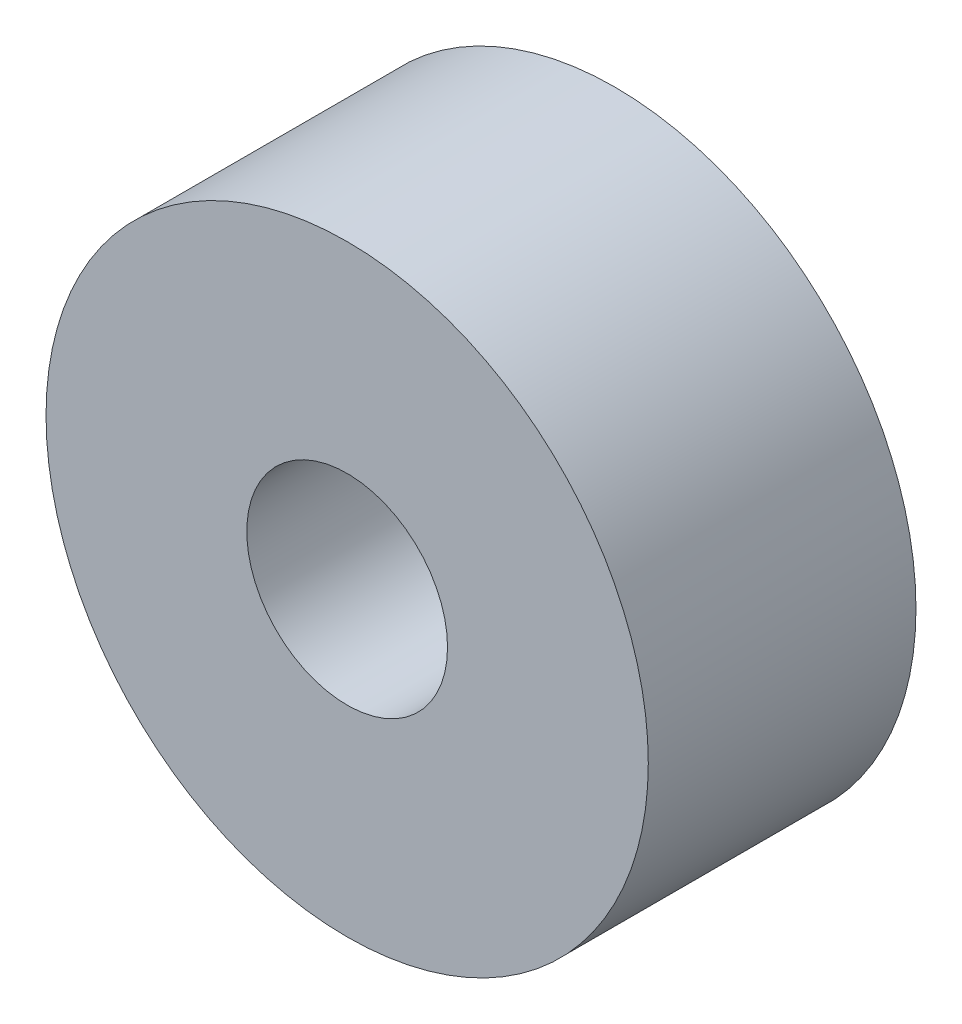
from build123d import *

# Parameters (mm, degrees)
SKETCH_1_R      = 4.5
SKETCH_1_R_2    = 1.5
EXTRUDE_1_DEPTH = 2


with BuildPart() as part:
    # 草图1 → 凸台-拉伸1 (new, symmetric)
    with BuildSketch(Plane.XY):
        Circle(SKETCH_1_R)
        Circle(SKETCH_1_R_2, mode=Mode.SUBTRACT)
    extrude(amount=EXTRUDE_1_DEPTH, both=True)


solid = part.part
